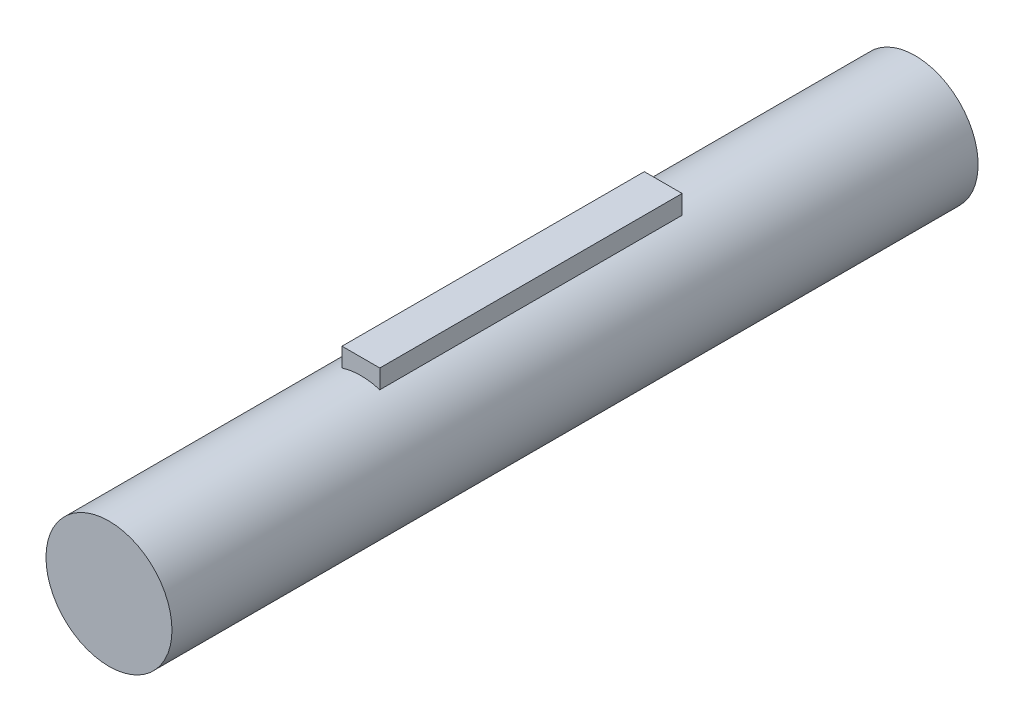
from build123d import *

# Parameters (mm, degrees)
BOSS_EXTRUDE1_DEPTH = 38.1
SKETCH2_R           = 7.9375
BOSS_EXTRUDE2_DEPTH = 31.75
BOSS_EXTRUDE3_START = 31.75
SKETCH3_R           = 7.9375
BOSS_EXTRUDE3_DEPTH = 31.75


with BuildPart() as part:
    # Sketch1 → Boss-Extrude1 (new body)
    with BuildSketch(Plane.XY):
        with BuildLine():
            Line((2.38125, 7.571892411), (2.38125, 9.953142411))
            Line((2.38125, 9.953142411), (-2.38125, 9.953142411))
            Line((-2.38125, 9.953142411), (-2.38125, 7.571892411))
            ThreePointArc((-2.38125, 7.571892411), (0, -7.9375), (2.38125, 7.571892411))
        make_face()
    extrude(amount=BOSS_EXTRUDE1_DEPTH)

    # Sketch2 → Boss-Extrude2 (add)
    with BuildSketch(Plane.XY.offset(38.1)):
        with Locations(Location((0, 0, 0), (0, 0, 107.457603124))):
            Circle(SKETCH2_R)
    extrude(amount=BOSS_EXTRUDE2_DEPTH)

    # Sketch3 → Boss-Extrude3 (add)
    with BuildSketch(Plane(origin=(0, 0, 0), x_dir=(-1, 0, 0), z_dir=(0, 0, -1)).offset(BOSS_EXTRUDE3_START)):
        Circle(SKETCH3_R)
    extrude(amount=-BOSS_EXTRUDE3_DEPTH)


solid = part.part
